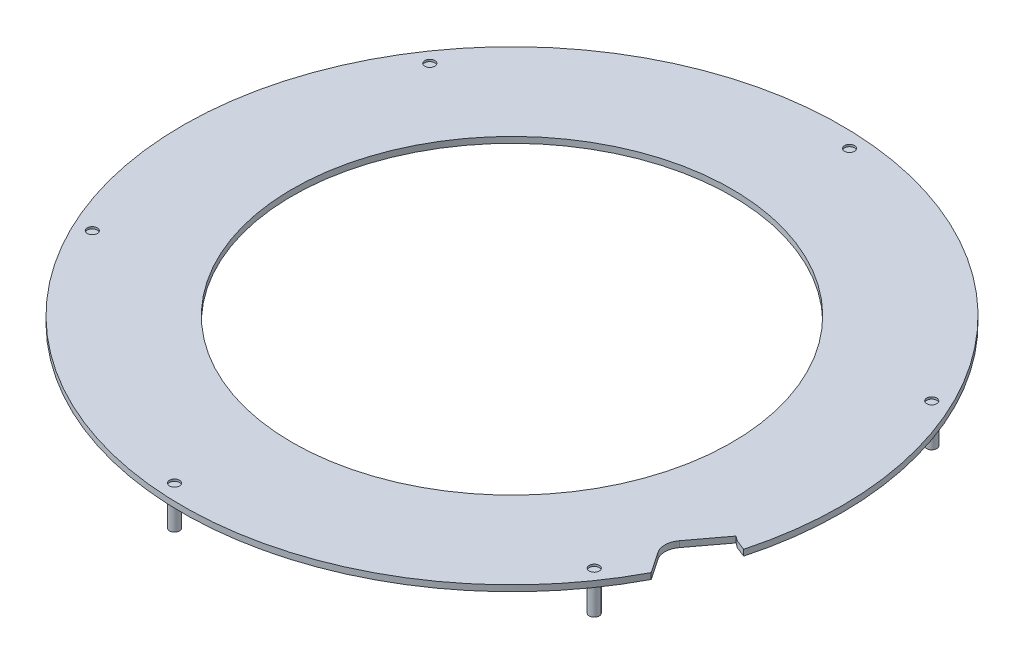
from build123d import *

# Parameters (mm, degrees)
SKETCH1_R           = 165
SKETCH1_R_2         = 110
BOSS_EXTRUDE1_DEPTH = 3
SKETCH4_R           = 2.5
BOSS_EXTRUDE2_DEPTH = 16.5
CIRPATTERN1_COUNT   = 6
CUT_EXTRUDE1_DEPTH  = 10
SKETCH6_R           = 2.5
CUT_EXTRUDE2_DEPTH  = 1
CIRPATTERN5_COUNT   = 6


with BuildPart() as part:
    # Sketch1 → Boss-Extrude1 (new body)
    with BuildSketch(Plane(origin=(0, 0, 0), x_dir=(1, 0, 0), z_dir=(0, 1, 0))):
        with Locations(Location((0, 0, 0), (0, 0, 270))):
            Circle(SKETCH1_R)
        with Locations(Location((0, 0, 0), (0, 0, 270))):
            Circle(SKETCH1_R_2, mode=Mode.SUBTRACT)
    extrude(amount=BOSS_EXTRUDE1_DEPTH)

    # Sketch4 → Boss-Extrude2 (add)
    with BuildSketch(Plane.XZ):
        with Locations(Location((-11.943664818, 157.046486337, 0), (0, 0, 90))):
            Circle(SKETCH4_R)
    boss_extrude2 = extrude(amount=BOSS_EXTRUDE2_DEPTH)

    # CirPattern1: Boss-Extrude2 ×6 about axis
    cirpattern1_axis = Axis((0, 0, 0), (0, 1, 0))
    for i in range(1, CIRPATTERN1_COUNT):
        add(boss_extrude2.rotate(cirpattern1_axis, i * 360 / CIRPATTERN1_COUNT))

    # Sketch5 → Cut-Extrude1 (cut)
    with BuildSketch(Plane(origin=(0, 0, 0), x_dir=(-1, 0, 0), z_dir=(0, -1, 0))):
        with BuildLine():
            Line((-139.418207286, -55.668125577), (-151.59368138, -39.414458013))
            Line((-151.59368138, -39.414458013), (-153.890000313, -41.134609577))
            Line((-153.890000313, -41.134609577), (-160.156367767, -43.657048272))
            ThreePointArc((-160.156367767, -43.657048272), (-154.417811813, -60.91912175), (-146.824907269, -77.449639157))
            Line((-146.824907269, -77.449639157), (-139.16221183, -66.09993074))
            ThreePointArc((-139.16221183, -66.09993074), (-137.624058072, -60.843140968), (-139.418207286, -55.668125577))
        make_face()
    extrude(amount=-CUT_EXTRUDE1_DEPTH, mode=Mode.SUBTRACT)

    # Sketch6 → Cut-Extrude2 (cut)
    with BuildSketch(Plane(origin=(0, 3, 0), x_dir=(1, 0, 0), z_dir=(0, 1, 0))):
        with Locations(Location((11.943664818, 157.046486337, 0), (0, 0, 270))):
            Circle(SKETCH6_R)
    cut_extrude2 = extrude(amount=-CUT_EXTRUDE2_DEPTH, mode=Mode.SUBTRACT)

    # CirPattern5: Cut-Extrude2 ×6 about axis
    cirpattern5_axis = Axis((0, 0, 0), (0, 1, 0))
    for i in range(1, CIRPATTERN5_COUNT):
        add(cut_extrude2.rotate(cirpattern5_axis, i * 360 / CIRPATTERN5_COUNT), mode=Mode.SUBTRACT)


solid = part.part
